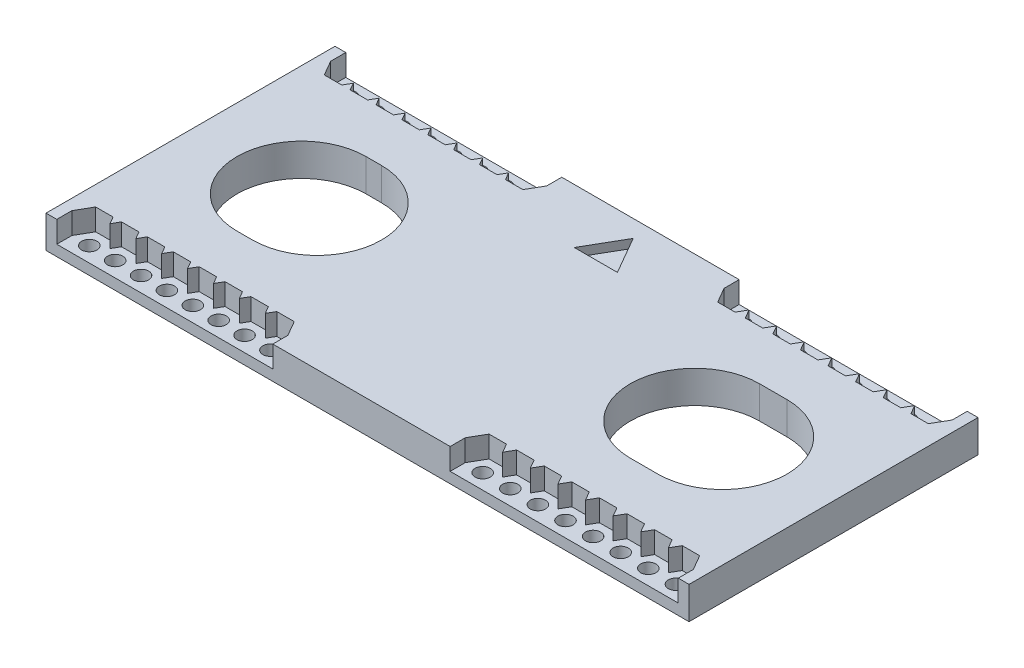
from build123d import *

# Parameters (mm, degrees)
SKETCH1_W           = 189.327955438
SKETCH1_H           = 42.541825
SKETCH1_R           = 2.2479
BOSS_EXTRUDE1_DEPTH = 9.525
SKETCH1_5_R         = 2.2479
CUT_EXTRUDE1_DEPTH  = 6.35
CUT_EXTRUDE2_DEPTH  = 187.199390462
CUT_EXTRUDE3_DEPTH  = 2.54


with BuildPart() as part:
    # Sketch1 → Boss-Extrude1 (new body)
    with BuildSketch(Plane(origin=(0, 0, 0), x_dir=(1, 0, 0), z_dir=(0, 1, 0))):
        with Locations((86.36, 21.2709125)):
            Rectangle(SKETCH1_W, SKETCH1_H)
        with Locations(Location((45.72, 38.1, 0), (0, 0, 270))):
            Circle(SKETCH1_R, mode=Mode.SUBTRACT)
        with Locations(Location((38.1, 38.1, 0), (0, 0, 270))):
            Circle(SKETCH1_R, mode=Mode.SUBTRACT)
        with Locations(Location((30.48, 38.1, 0), (0, 0, 270))):
            Circle(SKETCH1_R, mode=Mode.SUBTRACT)
        with Locations(Location((22.86, 38.1, 0), (0, 0, 270))):
            Circle(SKETCH1_R, mode=Mode.SUBTRACT)
        with Locations(Location((15.24, 38.1, 0), (0, 0, 270))):
            Circle(SKETCH1_R, mode=Mode.SUBTRACT)
        with Locations(Location((7.62, 38.1, 0), (0, 0, 270))):
            Circle(SKETCH1_R, mode=Mode.SUBTRACT)
        with Locations(Location((0, 38.1, 0), (0, 0, 270))):
            Circle(SKETCH1_R, mode=Mode.SUBTRACT)
        with Locations(Location((53.34, 38.1, 0), (0, 0, 270))):
            Circle(SKETCH1_R, mode=Mode.SUBTRACT)
        with Locations(Location((148.336, 38.1, 0), (0, 0, 270))):
            Circle(SKETCH1_R, mode=Mode.SUBTRACT)
        with Locations(Location((140.208, 38.1, 0), (0, 0, 270))):
            Circle(SKETCH1_R, mode=Mode.SUBTRACT)
        with Locations(Location((132.08, 38.1, 0), (0, 0, 270))):
            Circle(SKETCH1_R, mode=Mode.SUBTRACT)
        with Locations(Location((123.952, 38.1, 0), (0, 0, 270))):
            Circle(SKETCH1_R, mode=Mode.SUBTRACT)
        with Locations(Location((115.824, 38.1, 0), (0, 0, 270))):
            Circle(SKETCH1_R, mode=Mode.SUBTRACT)
        with Locations(Location((156.464, 38.1, 0), (0, 0, 270))):
            Circle(SKETCH1_R, mode=Mode.SUBTRACT)
        with Locations(Location((164.592, 38.1, 0), (0, 0, 270))):
            Circle(SKETCH1_R, mode=Mode.SUBTRACT)
        with Locations(Location((172.72, 38.1, 0), (0, 0, 270))):
            Circle(SKETCH1_R, mode=Mode.SUBTRACT)
    extrude(amount=-BOSS_EXTRUDE1_DEPTH)

    # Sketch1<5> → Cut-Extrude1 (cut)
    # profile 1 of 2: a face of its own
    with BuildSketch(Plane(origin=(0, 0, 0), x_dir=(1, 0, 0), z_dir=(0, 1, 0))):
        Polygon((-5.128977719, 38.1), (-2.564488859, 33.658175), (2.564488859, 33.658175), (3.81, 35.815463577), (5.055511141, 33.658175), (10.184488859, 33.658175), (11.43, 35.815463577), (12.675511141, 33.658175), (17.804488859, 33.658175), (19.05, 35.815463577), (20.295511141, 33.658175), (25.424488859, 33.658175), (26.67, 35.815463577), (27.915511141, 33.658175), (33.044488859, 33.658175), (34.29, 35.815463577), (35.535511141, 33.658175), (40.664488859, 33.658175), (41.91, 35.815463577), (43.155511141, 33.658175), (48.284488859, 33.658175), (49.53, 35.815463577), (50.775511141, 33.658175), (55.904488859, 33.658175), (58.468977719, 38.1), (58.468977719, 42.541825), (-5.128977719, 42.541825), align=None)
        with Locations((0, 38.1)):
            Circle(SKETCH1_5_R, mode=Mode.SUBTRACT)
        with Locations((7.62, 38.1)):
            Circle(SKETCH1_5_R, mode=Mode.SUBTRACT)
        with Locations((15.24, 38.1)):
            Circle(SKETCH1_5_R, mode=Mode.SUBTRACT)
        with Locations((22.86, 38.1)):
            Circle(SKETCH1_5_R, mode=Mode.SUBTRACT)
        with Locations((30.48, 38.1)):
            Circle(SKETCH1_5_R, mode=Mode.SUBTRACT)
        with Locations((38.1, 38.1)):
            Circle(SKETCH1_5_R, mode=Mode.SUBTRACT)
        with Locations((45.72, 38.1)):
            Circle(SKETCH1_5_R, mode=Mode.SUBTRACT)
        with Locations((53.34, 38.1)):
            Circle(SKETCH1_5_R, mode=Mode.SUBTRACT)
    # profile 2 of 2: a face of its own
    with BuildSketch(Plane(origin=(0, 0, 0), x_dir=(1, 0, 0), z_dir=(0, 1, 0))):
        Polygon((170.155511141, 33.658175), (175.284488859, 33.658175), (177.848977719, 38.1), (177.848977719, 42.541825), (110.695022281, 42.541825), (110.695022281, 38.1), (113.259511141, 33.658175), (118.388488859, 33.658175), (119.888, 36.255404482), (121.387511141, 33.658175), (126.516488859, 33.658175), (128.016, 36.255404482), (129.515511141, 33.658175), (134.644488859, 33.658175), (136.144, 36.255404482), (137.643511141, 33.658175), (142.772488859, 33.658175), (144.272, 36.255404482), (145.771511141, 33.658175), (150.900488859, 33.658175), (152.4, 36.255404482), (153.899511141, 33.658175), (159.028488859, 33.658175), (160.528, 36.255404482), (162.027511141, 33.658175), (167.156488859, 33.658175), (168.656, 36.255404482), align=None)
        with Locations((115.824, 38.1)):
            Circle(SKETCH1_5_R, mode=Mode.SUBTRACT)
        with Locations((123.952, 38.1)):
            Circle(SKETCH1_5_R, mode=Mode.SUBTRACT)
        with Locations((132.08, 38.1)):
            Circle(SKETCH1_5_R, mode=Mode.SUBTRACT)
        with Locations((140.208, 38.1)):
            Circle(SKETCH1_5_R, mode=Mode.SUBTRACT)
        with Locations((148.336, 38.1)):
            Circle(SKETCH1_5_R, mode=Mode.SUBTRACT)
        with Locations((156.464, 38.1)):
            Circle(SKETCH1_5_R, mode=Mode.SUBTRACT)
        with Locations((164.592, 38.1)):
            Circle(SKETCH1_5_R, mode=Mode.SUBTRACT)
        with Locations((172.72, 38.1)):
            Circle(SKETCH1_5_R, mode=Mode.SUBTRACT)
    extrude(amount=-CUT_EXTRUDE1_DEPTH, mode=Mode.SUBTRACT)

    # Mirror1: part across plane


with BuildPart() as part_1:
    add(part.part)
    add(part.part.mirror(Plane.XY))

    # Sketch2 → Cut-Extrude2 (cut, through all)
    with BuildSketch(Plane(origin=(0, 0, 0), x_dir=(1, 0, 0), z_dir=(0, 1, 0))):
        with BuildLine():
            Line((148.336, -19), (140.208, -19))
            ThreePointArc((140.208, -19), (121.208, 0), (140.208, 19))
            Line((140.208, 19), (148.336, 19))
            ThreePointArc((148.336, 19), (167.336, 0), (148.336, -19))
        make_face()
        with BuildLine():
            Line((28.956, -19), (24.384, -19))
            ThreePointArc((24.384, -19), (5.384, 0), (24.384, 19))
            Line((24.384, 19), (28.956, 19))
            ThreePointArc((28.956, 19), (47.956, 0), (28.956, -19))
        make_face()
    extrude(amount=-CUT_EXTRUDE2_DEPTH, mode=Mode.SUBTRACT)

    # Sketch4 → Cut-Extrude3 (cut)
    with BuildSketch(Plane(origin=(0, 0, 0), x_dir=(1, 0, 0), z_dir=(0, 1, 0))):
        Polygon((78.232, 26.463302372), (84.582, 37.461825), (90.932, 26.463302372), align=None)
    extrude(amount=-CUT_EXTRUDE3_DEPTH, mode=Mode.SUBTRACT)


solid = part_1.part
